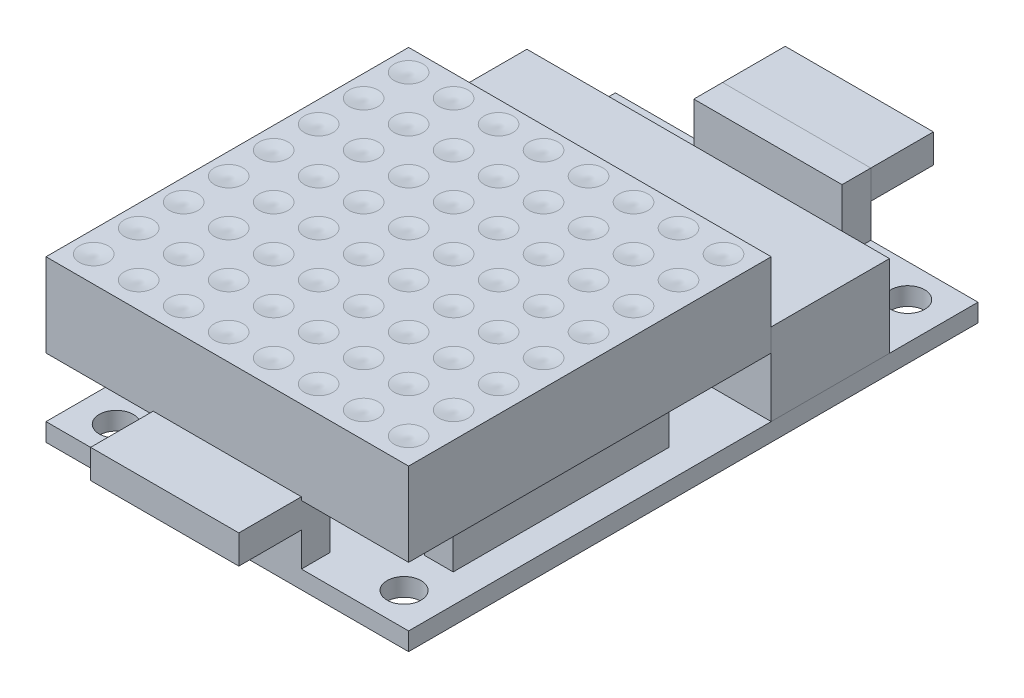
from build123d import *

# Parameters (mm, degrees)
SKETCH1_W            = 32
SKETCH1_H            = 32
BOSS_EXTRUDE1_DEPTH  = 7.3600056
SKETCH2_W            = 2.54
SKETCH2_H            = 19.05
BOSS_EXTRUDE2_DEPTH  = 5.238594298
SKETCH3_W            = 32
SKETCH3_H            = 50.25
BOSS_EXTRUDE3_DEPTH  = 1.5875
SKETCH4_R            = 1.5
CUT_EXTRUDE1_DEPTH   = 1.5875
LPATTERN1_COUNT      = 8
LPATTERN1_PITCH      = 3.97
LPATTERN1_COUNT_DIR2 = 8
LPATTERN1_PITCH_DIR2 = 3.97
SKETCH6_W            = 32
SKETCH6_H            = 10.4395
BOSS_EXTRUDE4_DEPTH  = 7.239
SKETCH7_W            = 13.081
SKETCH7_H            = 2.54
BOSS_EXTRUDE5_DEPTH  = 5.5245
SKETCH8_W            = 13.081
SKETCH8_H            = 2.54
BOSS_EXTRUDE6_DEPTH  = 5.5245


with BuildPart() as part:
    # Sketch1 → Boss-Extrude1 (new body)
    with BuildSketch(Plane(origin=(0, 0, 0), x_dir=(1, 0, 0), z_dir=(0, 1, 0))):
        with Locations((16, 16)):
            Rectangle(SKETCH1_W, SKETCH1_H)
    extrude(amount=BOSS_EXTRUDE1_DEPTH)

    # Sketch2 → Boss-Extrude2 (add)
    with BuildSketch(Plane.XZ):
        with Locations((28.19, -16)):
            Rectangle(SKETCH2_W, SKETCH2_H)
        with Locations((3.81, -16)):
            Rectangle(SKETCH2_W, SKETCH2_H)
    extrude(amount=BOSS_EXTRUDE2_DEPTH)

    # Sketch3 → Boss-Extrude3 (add)
    with BuildSketch(Plane.XZ.offset(5.238594298)):
        with Locations((16, -25.125)):
            Rectangle(SKETCH3_W, SKETCH3_H)
    extrude(amount=BOSS_EXTRUDE3_DEPTH)

    # Sketch4 → Cut-Extrude1 (cut)
    with BuildSketch(Plane.XZ.offset(6.826094298)):
        with Locations(Location((3.3, -47.35, 0), (0, 0, 270))):
            Circle(SKETCH4_R)
        with Locations(Location((28.7, -47.35, 0), (0, 0, 270))):
            Circle(SKETCH4_R)
        with Locations(Location((28.7, -2.9, 0), (0, 0, 270))):
            Circle(SKETCH4_R)
        with Locations(Location((3.3, -2.9, 0), (0, 0, 270))):
            Circle(SKETCH4_R)
    extrude(amount=-CUT_EXTRUDE1_DEPTH, mode=Mode.SUBTRACT)

    # Cut-Extrude2 cone 1 section (through the dimple's axis) → Cut-Extrude2 (revolve, cut)
    with BuildSketch(Plane(origin=(1.905, 7.3600056, -30.095), x_dir=(0, 0, 1), z_dir=(1, 0, 0))):
        Polygon((0, 0), (1.27, 0), (0, 0.223935265), align=None)
    cut_extrude2 = revolve(axis=Axis((1.905, 7.3600056, -30.095), (0, -1, 0)), mode=Mode.SUBTRACT)

    # LPattern1: Cut-Extrude2 8 × 8
    with Locations(*[(i * LPATTERN1_PITCH, 0, j * LPATTERN1_PITCH_DIR2) for i in range(LPATTERN1_COUNT) for j in range(LPATTERN1_COUNT_DIR2) if (i, j) != (0, 0)]):
        add(cut_extrude2, mode=Mode.SUBTRACT)


with BuildPart() as body_2:
    # Sketch6 → Boss-Extrude4 (new body)
    with BuildSketch(Plane(origin=(0, -5.238594298, 0), x_dir=(1, 0, 0), z_dir=(0, 1, 0))):
        with Locations((16, 37.21975)):
            Rectangle(SKETCH6_W, SKETCH6_H)
    extrude(amount=BOSS_EXTRUDE4_DEPTH)


with BuildPart() as body_3:
    # Sketch7 → Boss-Extrude5 (new body)
    with BuildSketch(Plane(origin=(0, -5.238594298, 0), x_dir=(1, 0, 0), z_dir=(0, 1, 0))):
        with Locations((16, 48.98)):
            Rectangle(SKETCH7_W, SKETCH7_H)
    boss_extrude5 = extrude(amount=BOSS_EXTRUDE5_DEPTH)


with BuildPart() as body_4:
    # Sketch8 → Boss-Extrude6 (new body)
    with BuildSketch(Plane(origin=(0, 0, -50.25), x_dir=(-1, 0, 0), z_dir=(0, 0, -1))):
        with Locations((-16, -0.984094298)):
            Rectangle(SKETCH8_W, SKETCH8_H)
    boss_extrude6 = extrude(amount=BOSS_EXTRUDE6_DEPTH)


with BuildPart() as part_1:
    add(part.part)

    # Mirror1: Boss-Extrude5, Boss-Extrude6 across plane
    add(boss_extrude5.mirror(Plane(origin=(0, 0, -25.125), x_dir=(1, 0, 0), z_dir=(0, 0, -1))))
    add(boss_extrude6.mirror(Plane(origin=(0, 0, -25.125), x_dir=(1, 0, 0), z_dir=(0, 0, -1))))


solid = Compound([body_2.part, body_3.part, body_4.part, part_1.part])
